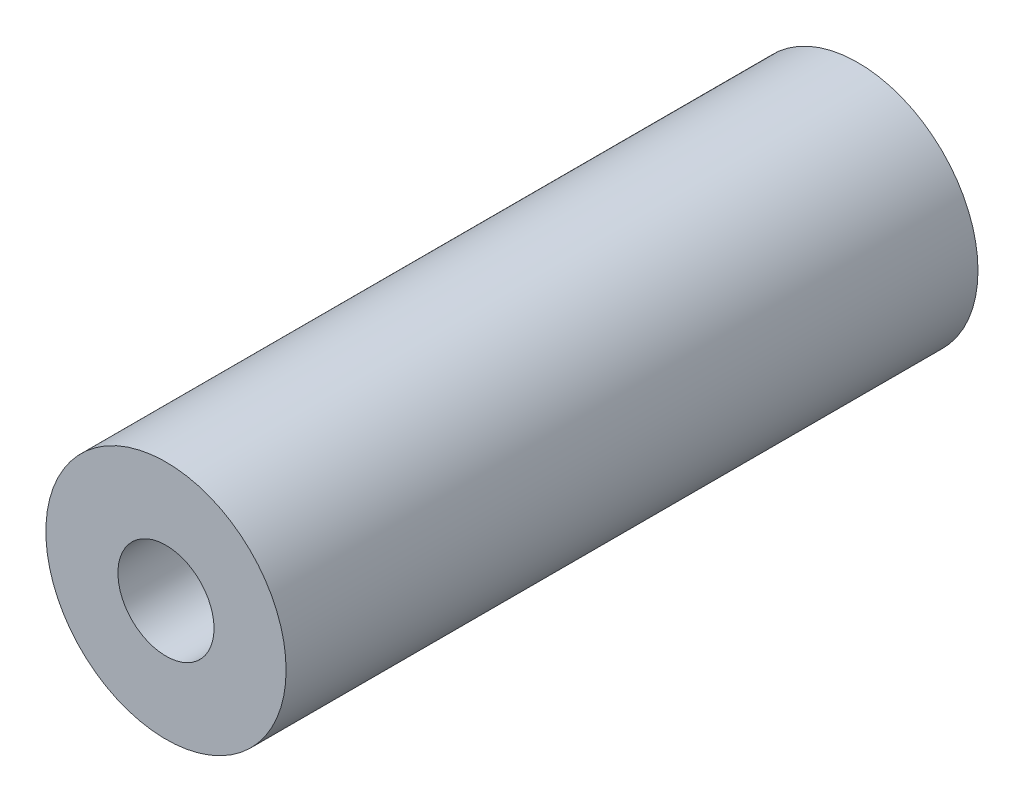
from build123d import *

# Parameters (mm, degrees)
SKETCH1_R           = 3.175
SKETCH1_R_2         = 1.27
BOSS_EXTRUDE2_DEPTH = 18.288


with BuildPart() as part:
    # Sketch1 → Boss-Extrude2 (new body)
    with BuildSketch(Plane.XY):
        Circle(SKETCH1_R)
        Circle(SKETCH1_R_2, mode=Mode.SUBTRACT)
    extrude(amount=BOSS_EXTRUDE2_DEPTH)


solid = part.part
